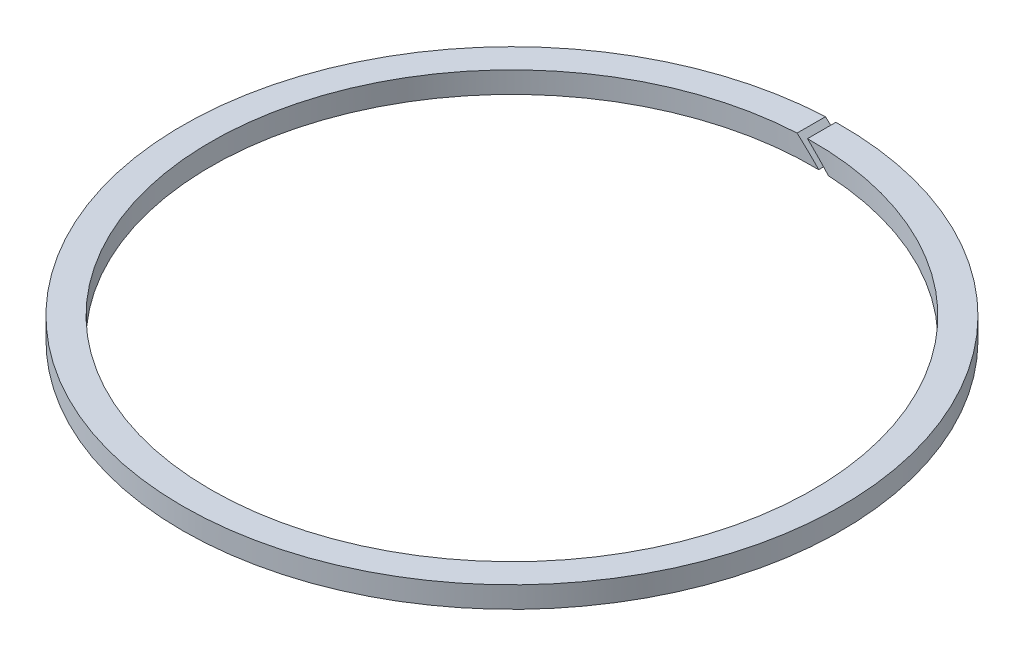
from build123d import *

# Parameters (mm, degrees)
SKETCH2_R               = 46.5
SKETCH2_R_2             = 42.5
BOSS_EXTRUDE1_DEPTH     = 1.5
CUT_EXTRUDE1_REACH      = 67.778
CUT_EXTRUDE1_END_RADIUS = 46.5


with BuildPart() as part:
    # Sketch2 → Boss-Extrude1 (new, symmetric)
    with BuildSketch(Plane(origin=(0, 0, 0), x_dir=(1, 0, 0), z_dir=(0, 1, 0))):
        with Locations(Location((0, 0, 0), (0, 0, 270))):
            Circle(SKETCH2_R)
        with Locations(Location((0, 0, 0), (0, 0, 270))):
            Circle(SKETCH2_R_2, mode=Mode.SUBTRACT)
    extrude(amount=BOSS_EXTRUDE1_DEPTH, both=True)

    # Cut-Extrude1: up to this cylinder (the profile starts inside it)
    cut_extrude1_end = Plane(origin=(0, 0, 0), z_dir=(0, -1, 0)) * Cylinder(CUT_EXTRUDE1_END_RADIUS, 229.556, mode=Mode.PRIVATE)
    # Sketch3 → Cut-Extrude1 (cut, up to the surface)
    with BuildSketch(Plane.XY, mode=Mode.PRIVATE) as cut_extrude1_sk1:
        Polygon((-5.449216167, 6.156322948), (6.156322948, -5.449216167), (5.449216167, -6.156322948), (-6.156322948, 5.449216167), align=None)
    cut_extrude1_tool1 = extrude(cut_extrude1_sk1.sketch, amount=-CUT_EXTRUDE1_REACH, mode=Mode.PRIVATE) & cut_extrude1_end
    add(cut_extrude1_tool1.solids().sort_by_distance((0, 0, 0))[0], mode=Mode.SUBTRACT)


solid = part.part
